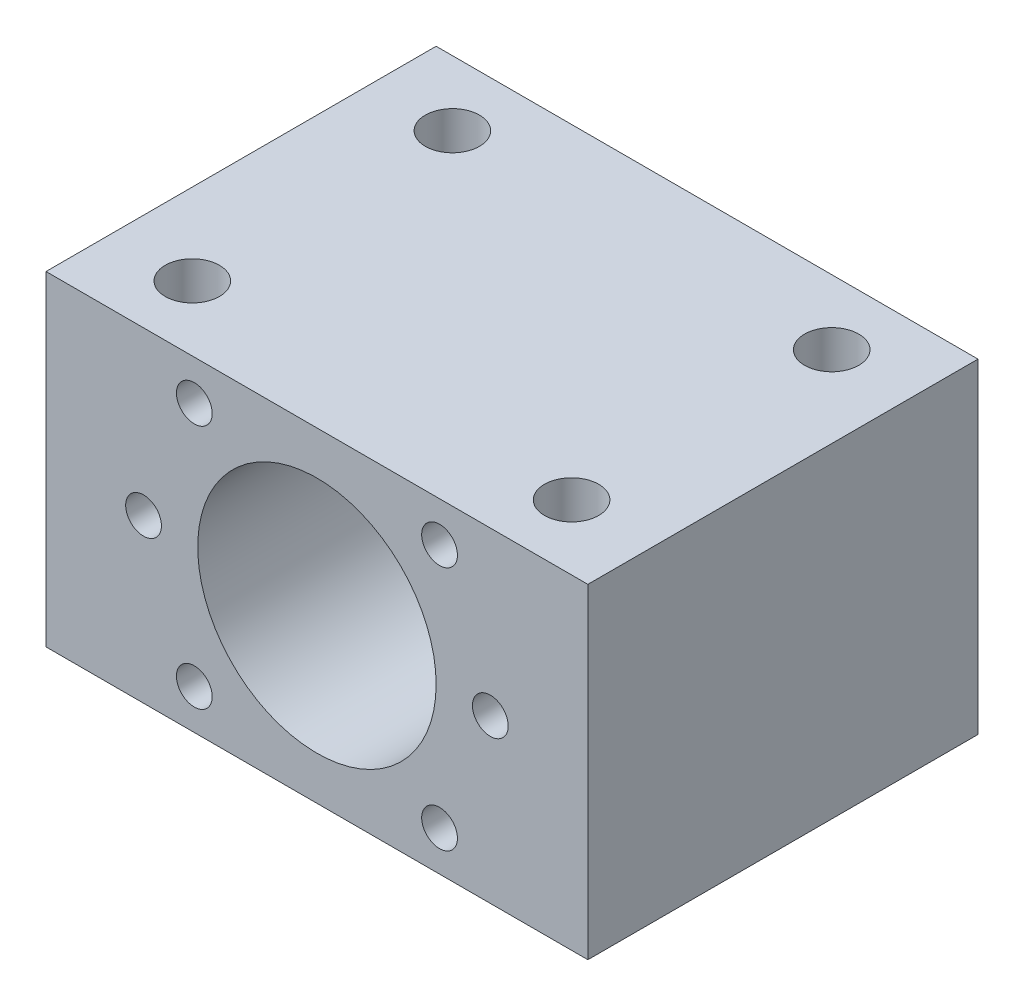
from build123d import *

# Parameters (mm, degrees)
SKETCH2_W                   = 50
SKETCH2_H                   = 30
SKETCH2_R                   = 11
BOSS_EXTRUDE1_DEPTH         = 36
TAP_DRILL_FOR_M4_TAP1_D     = 3.3
TAP_DRILL_FOR_M4_TAP1_DEPTH = 7.008579979
TAP_DRILL_FOR_M4_TAP1_TIP   = 0.991420021
SKETCH5_R                   = 2.5
CUT_EXTRUDE1_DEPTH          = 12


with BuildPart() as part:
    # Sketch2 → Boss-Extrude1 (new body)
    with BuildSketch(Plane.XY):
        Rectangle(SKETCH2_W, SKETCH2_H)
        Circle(SKETCH2_R, mode=Mode.SUBTRACT)
    extrude(amount=BOSS_EXTRUDE1_DEPTH)

    # Tap Drill for M4 Tap1
    with Locations(Plane.XY.offset(36)):
        with Locations((11.313708499, 11.313708499), (-16, 0), (-11.313708499, 11.313708499), (-11.313708499, -11.313708499), (11.313708499, -11.313708499), (16, 0)):
            Hole(TAP_DRILL_FOR_M4_TAP1_D / 2, depth=TAP_DRILL_FOR_M4_TAP1_DEPTH)
            with Locations((0, 0, -(TAP_DRILL_FOR_M4_TAP1_DEPTH + TAP_DRILL_FOR_M4_TAP1_TIP / 2))):  # 118° drill point
                Cone(0, TAP_DRILL_FOR_M4_TAP1_D / 2, TAP_DRILL_FOR_M4_TAP1_TIP, mode=Mode.SUBTRACT)

    # Sketch5 → Cut-Extrude1 (cut)
    with BuildSketch(Plane(origin=(0, 15, 0), x_dir=(1, 0, 0), z_dir=(0, 1, 0))):
        with Locations(Location((-17.5, -6, 0), (0, 0, 270))):
            Circle(SKETCH5_R)
        with Locations(Location((17.5, -6, 0), (0, 0, 270))):
            Circle(SKETCH5_R)
        with Locations(Location((17.5, -30, 0), (0, 0, 270))):
            Circle(SKETCH5_R)
        with Locations(Location((-17.5, -30, 0), (0, 0, 270))):
            Circle(SKETCH5_R)
    extrude(amount=-CUT_EXTRUDE1_DEPTH, mode=Mode.SUBTRACT)


solid = part.part
